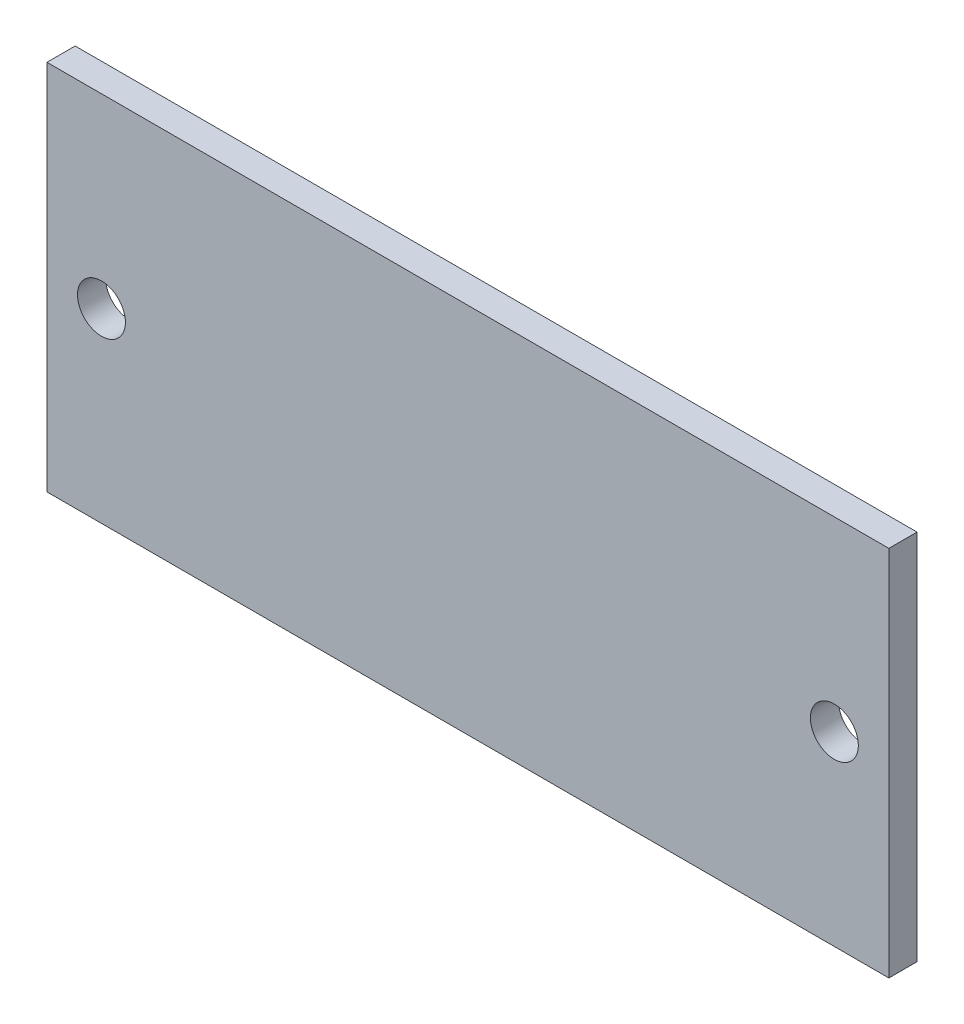
from build123d import *

# Parameters (mm, degrees)
SKETCH2_W           = 44.8
SKETCH2_H           = 19.8
BOSS_EXTRUDE1_DEPTH = 1.5
SKETCH3_R           = 1.275
CUT_EXTRUDE1_DEPTH  = 25.536095859


with BuildPart() as part:
    # Sketch2 → Boss-Extrude1 (new body)
    with BuildSketch(Plane.XY):
        Rectangle(SKETCH2_W, SKETCH2_H)
    extrude(amount=BOSS_EXTRUDE1_DEPTH)

    # Sketch3 → Cut-Extrude1 (cut, through all)
    with BuildSketch(Plane.XY.offset(1.5)):
        with Locations((-19.5, 0)):
            Circle(SKETCH3_R)
    cut_extrude1 = extrude(amount=-CUT_EXTRUDE1_DEPTH, mode=Mode.SUBTRACT)

    # Mirror1: Cut-Extrude1 across plane
    add(cut_extrude1.mirror(Plane(origin=(0, 0, 0), x_dir=(0, 0, 1), z_dir=(1, 0, 0))), mode=Mode.SUBTRACT)


solid = part.part
